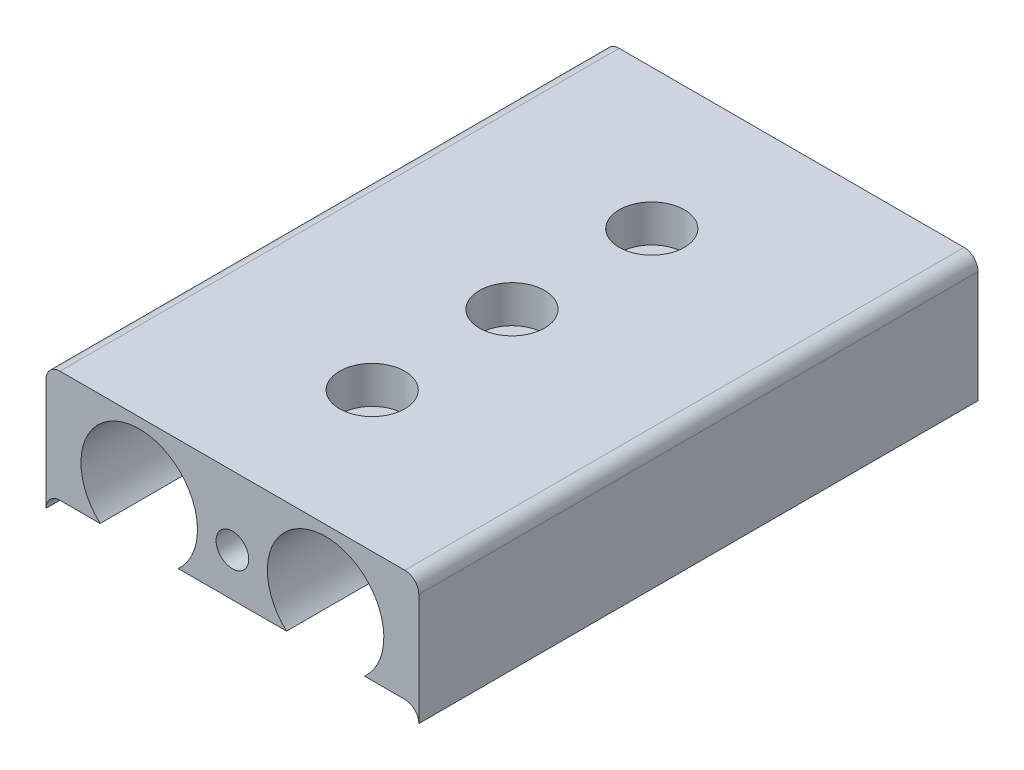
from build123d import *

# Parameters (mm, degrees)
SKETCH_1_R          = 3.5
EXTRUDE_1_DEPTH     = 60
SKETCH_2_R          = 6.25
CUT_EXTRUDE_1_DEPTH = 20
CUT_EXTRUDE_START   = -20
SKETCH_3_R          = 6.25
CUT_EXTRUDE_2_DEPTH = 20
SKETCH_4_R          = 3.5
CUT_EXTRUDE_3_DEPTH = 4
SKETCH_5_R          = 3.5
CUT_EXTRUDE_4_DEPTH = 4
SKETCH_6_R          = 1.75
CUT_EXTRUDE_5_DEPTH = 14
SKETCH_7_R          = 1.75
CUT_EXTRUDE_6_DEPTH = 10
CUT_EXTRUDE_START_2 = -10
SKETCH_8_R          = 1.75
CUT_EXTRUDE_7_DEPTH = 10


with BuildPart() as part:
    # 草图1 → 凸台-拉伸1 (new body)
    with BuildSketch(Plane.XY):
        with BuildLine():
            Line((38.795098039, 43.765686275), (1.795098039, 43.765686275))
            ThreePointArc((1.795098039, 43.765686275), (0.734437867, 43.326346446), (0.295098039, 42.265686275))
            Line((0.295098039, 42.265686275), (0.295098039, 30.265686275))
            ThreePointArc((0.295098039, 30.265686275), (0.734437867, 31.326346446), (1.795098039, 31.765686275))
            Line((1.795098039, 31.765686275), (38.795098039, 31.765686275))
            ThreePointArc((38.795098039, 31.765686275), (39.855758211, 31.326346446), (40.295098039, 30.265686275))
            Line((40.295098039, 30.265686275), (40.295098039, 42.265686275))
            ThreePointArc((40.295098039, 42.265686275), (39.855758211, 43.326346446), (38.795098039, 43.765686275))
        make_face()
        with Locations((30.295098039, 36.405686275)):
            Circle(SKETCH_1_R, mode=Mode.SUBTRACT)
        with Locations((10.295098039, 36.405686275)):
            Circle(SKETCH_1_R, mode=Mode.SUBTRACT)
    extrude(amount=EXTRUDE_1_DEPTH)

    # 草图2 → 切除-拉伸1 (cut)
    with BuildSketch(Plane.XY.offset(60)):
        with Locations((10.295098039, 36.405686275)):
            Circle(SKETCH_2_R)
        with Locations((30.295098039, 36.405686275)):
            Circle(SKETCH_2_R)
    extrude(amount=-CUT_EXTRUDE_1_DEPTH, mode=Mode.SUBTRACT)

    # 草图3 → 切除-拉伸2 (cut)
    with BuildSketch(Plane(origin=(0, 0, 0), x_dir=(-1, 0, 0), z_dir=(0, 0, -1)).offset(CUT_EXTRUDE_START)):
        with Locations((-10.295098039, 36.405686275)):
            Circle(SKETCH_3_R)
        with Locations((-30.295098039, 36.405686275)):
            Circle(SKETCH_3_R)
    extrude(amount=CUT_EXTRUDE_2_DEPTH, mode=Mode.SUBTRACT)

    # 草图4 → 切除-拉伸3 (cut)
    with BuildSketch(Plane(origin=(0, 43.765686275, 0), x_dir=(1, 0, 0), z_dir=(0, 1, 0))):
        with Locations(Location((20.295098039, -30, 0), (0, 0, 270))):
            Circle(SKETCH_4_R)
    extrude(amount=-CUT_EXTRUDE_3_DEPTH, mode=Mode.SUBTRACT)

    # 草图5 → 切除-拉伸4 (cut)
    with BuildSketch(Plane(origin=(0, 43.765686275, 0), x_dir=(1, 0, 0), z_dir=(0, 1, 0))):
        with Locations(Location((20.295098039, -15, 0), (0, 0, 270))):
            Circle(SKETCH_5_R)
        with Locations(Location((20.295098039, -45, 0), (0, 0, 270))):
            Circle(SKETCH_5_R)
    extrude(amount=-CUT_EXTRUDE_4_DEPTH, mode=Mode.SUBTRACT)

    # 草图6 → 切除-拉伸5 (cut)
    with BuildSketch(Plane(origin=(0, 39.765686275, 0), x_dir=(1, 0, 0), z_dir=(0, 1, 0))):
        with Locations(Location((20.295098039, -30, 0), (0, 0, 270))):
            Circle(SKETCH_6_R)
        with Locations(Location((20.295098039, -15, 0), (0, 0, 270))):
            Circle(SKETCH_6_R)
        with Locations(Location((20.295098039, -45, 0), (0, 0, 270))):
            Circle(SKETCH_6_R)
    extrude(amount=-CUT_EXTRUDE_5_DEPTH, mode=Mode.SUBTRACT)

    # 草图7 → 切除-拉伸6 (cut)
    with BuildSketch(Plane.XY.offset(60)):
        with Locations((20.295098039, 36.405686275)):
            Circle(SKETCH_7_R)
    extrude(amount=-CUT_EXTRUDE_6_DEPTH, mode=Mode.SUBTRACT)

    # 草图8 → 切除-拉伸7 (cut)
    with BuildSketch(Plane(origin=(0, 0, 0), x_dir=(-1, 0, 0), z_dir=(0, 0, -1)).offset(CUT_EXTRUDE_START_2)):
        with Locations(Location((-20.295098039, 36.405686275, 0), (0, 0, 180))):
            Circle(SKETCH_8_R)
    extrude(amount=CUT_EXTRUDE_7_DEPTH, mode=Mode.SUBTRACT)


solid = part.part
